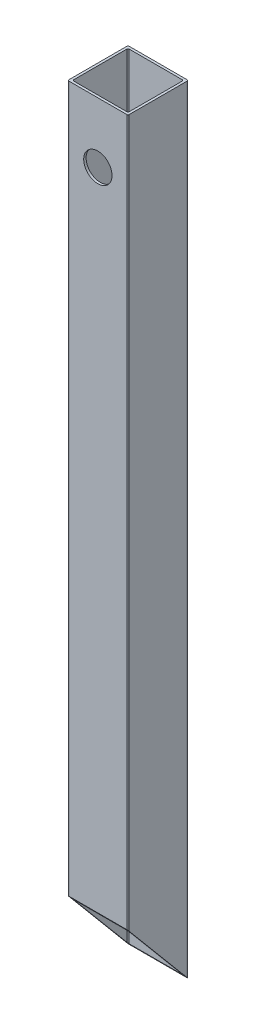
from build123d import *

# Parameters (mm, degrees)
BOSS_EXTRU_1_DEPTH      = 1500
ENL_V_MAT_EXTRU_1_DEPTH = 1507.651917332
ESQUISSE5_R             = 23.5
ENL_V_MAT_EXTRU_2_DEPTH = 1507.651917332
ESQUISSE6_W             = 100
ESQUISSE6_H             = 129
ENL_V_MAT_EXTRU_3_DEPTH = 1507.651917332


with BuildPart() as part:
    # Esquisse2 → Boss.-Extru.1 (new body)
    with BuildSketch(Plane(origin=(0, 0, 0), x_dir=(1, 0, 0), z_dir=(0, 1, 0))):
        with BuildLine():
            Line((2, 0), (98, 0))
            ThreePointArc((98, 0), (99.414213562, 0.585786438), (100, 2))
            Line((100, 2), (100, 98))
            ThreePointArc((100, 98), (99.414213562, 99.414213562), (98, 100))
            Line((98, 100), (2, 100))
            ThreePointArc((2, 100), (0.585786438, 99.414213562), (0, 98))
            Line((0, 98), (0, 2))
            ThreePointArc((0, 2), (0.585786438, 0.585786438), (2, 0))
        make_face()
        with BuildLine():
            Line((6, 96), (94, 96))
            ThreePointArc((94, 96), (95.414213562, 95.414213562), (96, 94))
            Line((96, 94), (96, 6))
            ThreePointArc((96, 6), (95.414213562, 4.585786438), (94, 4))
            Line((94, 4), (6, 4))
            ThreePointArc((6, 4), (4.585786438, 4.585786438), (4, 6))
            Line((4, 6), (4, 94))
            ThreePointArc((4, 94), (4.585786438, 95.414213562), (6, 96))
        make_face(mode=Mode.SUBTRACT)
    extrude(amount=BOSS_EXTRU_1_DEPTH)

    # Esquisse4 → Enlèv. mat.-Extru.1 (cut, through all)
    with BuildSketch(Plane.ZY):
        Polygon((0, 200), (-206.800963523, -46.455791231), (114.552024245, -46.455791231), (114.552024245, 200), align=None)
    extrude(amount=-ENL_V_MAT_EXTRU_1_DEPTH, mode=Mode.SUBTRACT)

    # Esquisse5 → Enlèv. mat.-Extru.2 (cut, through all)
    with BuildSketch(Plane(origin=(0, 0, -100), x_dir=(-1, 0, 0), z_dir=(0, 0, -1))):
        with Locations((-50, 1271)):
            Circle(ESQUISSE5_R)
    extrude(amount=-ENL_V_MAT_EXTRU_2_DEPTH, mode=Mode.SUBTRACT)

    # Esquisse6 → Enlèv. mat.-Extru.3 (cut, through all)
    with BuildSketch(Plane(origin=(0, 0, -100), x_dir=(-1, 0, 0), z_dir=(0, 0, -1))):
        with Locations((-50, 1435.5)):
            Rectangle(ESQUISSE6_W, ESQUISSE6_H)
    extrude(amount=-ENL_V_MAT_EXTRU_3_DEPTH, mode=Mode.SUBTRACT)


solid = part.part
